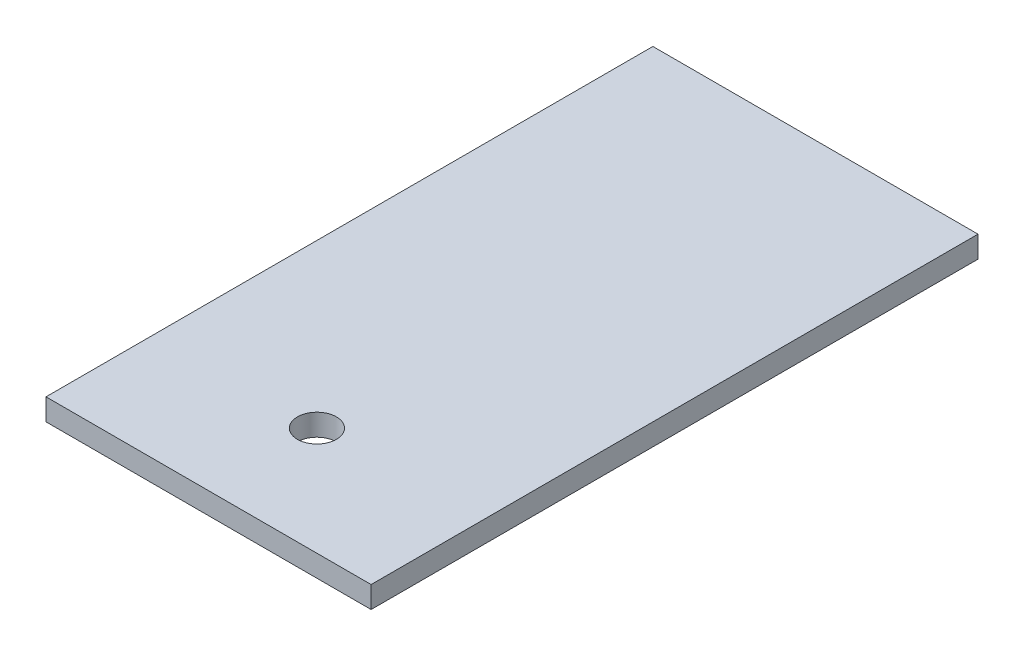
from build123d import *

# Parameters (mm, degrees)
SKETCH1_W           = 150
SKETCH1_H           = 280
SKETCH1_R           = 9
BOSS_EXTRUDE1_DEPTH = 10


with BuildPart() as part:
    # Sketch1 → Boss-Extrude1 (new body)
    with BuildSketch(Plane(origin=(0, 0, 0), x_dir=(1, 0, 0), z_dir=(0, 1, 0))):
        Rectangle(SKETCH1_W, SKETCH1_H)
        with Locations(Location((0, -90, 0), (0, 0, 270))):
            Circle(SKETCH1_R, mode=Mode.SUBTRACT)
    extrude(amount=BOSS_EXTRUDE1_DEPTH)


solid = part.part
